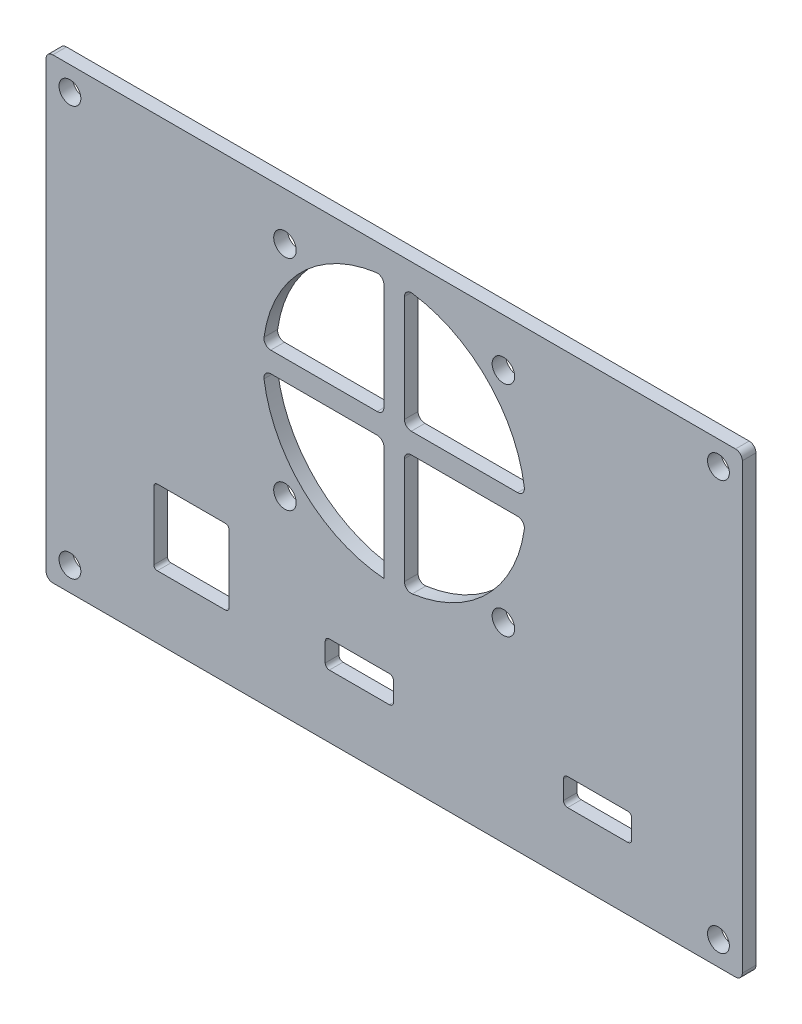
from build123d import *

# Parameters (mm, degrees)
SKETCH_1_W          = 102
SKETCH_1_H          = 67
EXTRUDE_1_DEPTH     = 2
SKETCH_2_R          = 1.6
CUT_EXTRUDE_1_DEPTH = 123.05326706
FILLET_1_R          = 1
SKETCH_3_R          = 1.65
SKETCH_3_W          = 10
SKETCH_3_H          = 3.95
SKETCH_3_W_2        = 11
SKETCH_3_H_2        = 11
CUT_EXTRUDE_2_DEPTH = 123.05326706
FILLET_2_R          = 1
FILLET_3_R          = 0.6
FILLET_4_R          = 0.5


with BuildPart() as part:
    # 草图1 → 凸台-拉伸1 (new body)
    with BuildSketch(Plane.XY):
        with Locations((51, 33.5)):
            Rectangle(SKETCH_1_W, SKETCH_1_H)
    extrude(amount=EXTRUDE_1_DEPTH)

    # 草图2 → 切除-拉伸1 (cut, through all)
    with BuildSketch(Plane.XY.offset(2)):
        with Locations((3.5, 63.5)):
            Circle(SKETCH_2_R)
        with Locations((98.5, 63.5)):
            Circle(SKETCH_2_R)
        with Locations((98.5, 3.5)):
            Circle(SKETCH_2_R)
        with Locations((3.5, 3.5)):
            Circle(SKETCH_2_R)
    extrude(amount=-CUT_EXTRUDE_1_DEPTH, mode=Mode.SUBTRACT)

    # 圆角1
    fillet_1_edges = [part.edges().sort_by_distance(p)[0] for p in [
        (0, 67, 1),
        (102, 67, 1),
        (102, 0, 1),
        (0, 0, 1),
    ]]
    fillet(fillet_1_edges, radius=FILLET_1_R)

    # 草图3 → 切除-拉伸2 (cut, through all)
    with BuildSketch(Plane.XY.offset(2)):
        with Locations((35, 60)):
            Circle(SKETCH_3_R)
        with Locations((67, 60)):
            Circle(SKETCH_3_R)
        with Locations((67, 28)):
            Circle(SKETCH_3_R)
        with Locations((35, 28)):
            Circle(SKETCH_3_R)
        with Locations((80.8, 11.175)):
            Rectangle(SKETCH_3_W, SKETCH_3_H)
        with Locations((45.9, 11.175)):
            Rectangle(SKETCH_3_W, SKETCH_3_H)
        with Locations((21.3, 14.7)):
            Rectangle(SKETCH_3_W_2, SKETCH_3_H_2)
        with BuildLine():
            Line((52.5, 42.5), (70.191469459, 42.5))
            ThreePointArc((70.191469459, 42.5), (64.611805538, 30.388194462), (52.5, 24.808530541))
            Line((52.5, 24.808530541), (52.5, 42.5))
        make_face()
        with BuildLine():
            Line((31.808530541, 45.5), (49.5, 45.5))
            Line((49.5, 45.5), (49.5, 63.191469459))
            ThreePointArc((49.5, 63.191469459), (37.388194462, 57.611805538), (31.808530541, 45.5))
        make_face()
        with BuildLine():
            Line((31.808530541, 42.5), (49.5, 42.5))
            Line((49.5, 42.5), (49.5, 24.808530541))
            ThreePointArc((49.5, 24.808530541), (37.388194462, 30.388194462), (31.808530541, 42.5))
        make_face()
        with BuildLine():
            Line((52.5, 63.191469459), (52.5, 45.5))
            Line((52.5, 45.5), (70.191469459, 45.5))
            ThreePointArc((70.191469459, 45.5), (64.611805538, 57.611805538), (52.5, 63.191469459))
        make_face()
    extrude(amount=-CUT_EXTRUDE_2_DEPTH, mode=Mode.SUBTRACT)

    # 圆角2
    fillet_2_edges = [part.edges().sort_by_distance(p)[0] for p in [
        (70.191469459, 42.5, 1),
        (52.5, 24.808530541, 1),
        (52.5, 42.5, 1),
        (31.808530541, 45.5, 1),
        (49.5, 63.191469459, 1),
        (49.5, 45.5, 1),
        (31.808530541, 42.5, 1),
        (49.5, 42.5, 1),
        (52.5, 63.191469459, 1),
        (70.191469459, 45.5, 1),
        (52.5, 45.5, 1),
    ]]
    fillet(fillet_2_edges, radius=FILLET_2_R)

    # 圆角3
    fillet_3_edges = [part.edges().sort_by_distance(p)[0] for p in [
        (75.8, 9.2, 1),
        (75.8, 13.15, 1),
        (85.8, 13.15, 1),
        (85.8, 9.2, 1),
        (40.9, 9.2, 1),
        (40.9, 13.15, 1),
        (50.9, 13.15, 1),
        (50.9, 9.2, 1),
    ]]
    fillet(fillet_3_edges, radius=FILLET_3_R)

    # 圆角4
    fillet_4_edges = [part.edges().sort_by_distance(p)[0] for p in [
        (26.8, 20.2, 1),
        (26.8, 9.2, 1),
        (15.8, 9.2, 1),
        (15.8, 20.2, 1),
    ]]
    fillet(fillet_4_edges, radius=FILLET_4_R)


solid = part.part
